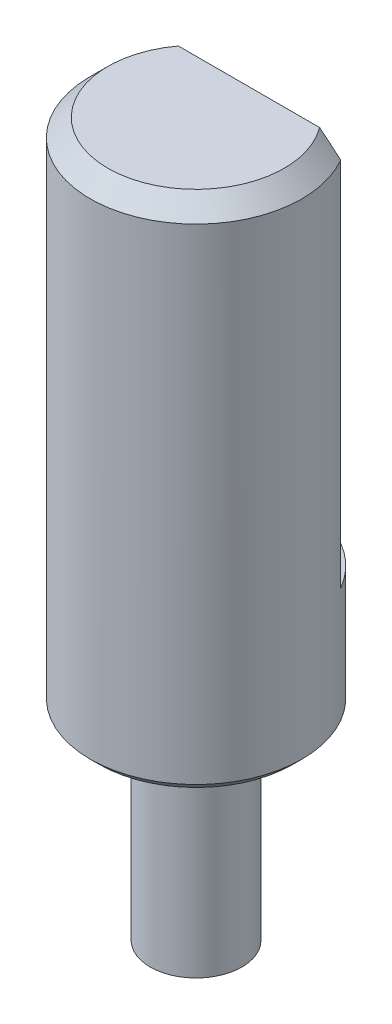
from build123d import *

# Parameters (mm, degrees)
SKETCH_1_R          = 1.3
EXTRUDE_1_DEPTH     = 5.7
SKETCH_2_R          = 3
EXTRUDE_2_DEPTH     = 14.5
CHAMFER_1_SIZE      = 0.25
CUT_EXTRUDE_START   = -11
CUT_EXTRUDE_1_DEPTH = 11
CHAMFER_2_SIZE      = 0.5


with BuildPart() as part:
    # 草图1 → 凸台-拉伸1 (new body)
    with BuildSketch(Plane(origin=(0, 0, 0), x_dir=(1, 0, 0), z_dir=(0, 1, 0))):
        with Locations(Location((0, 0, 0), (0, 0, 270))):
            Circle(SKETCH_1_R)
    extrude(amount=EXTRUDE_1_DEPTH)

    # 草图2 → 凸台-拉伸2 (add)
    with BuildSketch(Plane(origin=(0, 5.7, 0), x_dir=(1, 0, 0), z_dir=(0, 1, 0))):
        with Locations(Location((0, 0, 0), (0, 0, 90))):
            Circle(SKETCH_2_R)
    extrude(amount=EXTRUDE_2_DEPTH)

    # 倒角1
    chamfer_1_edges = [part.edges().sort_by_distance(p)[0] for p in [
        (0, 5.7, 3),
    ]]
    chamfer(chamfer_1_edges, length=CHAMFER_1_SIZE)

    # 草图3 → 切除-拉伸1 (cut)
    with BuildSketch(Plane(origin=(0, 20.2, 0), x_dir=(1, 0, 0), z_dir=(0, 1, 0)).offset(CUT_EXTRUDE_START)):
        with BuildLine():
            Line((-2.598076211, 1.5), (2.598076211, 1.5))
            ThreePointArc((2.598076211, 1.5), (0, 3), (-2.598076211, 1.5))
        make_face()
    extrude(amount=CUT_EXTRUDE_1_DEPTH, mode=Mode.SUBTRACT)

    # 倒角2
    chamfer_2_edges = [part.edges().sort_by_distance(p)[0] for p in [
        (0, 20.2, 3),
    ]]
    chamfer(chamfer_2_edges, length=CHAMFER_2_SIZE)


solid = part.part
